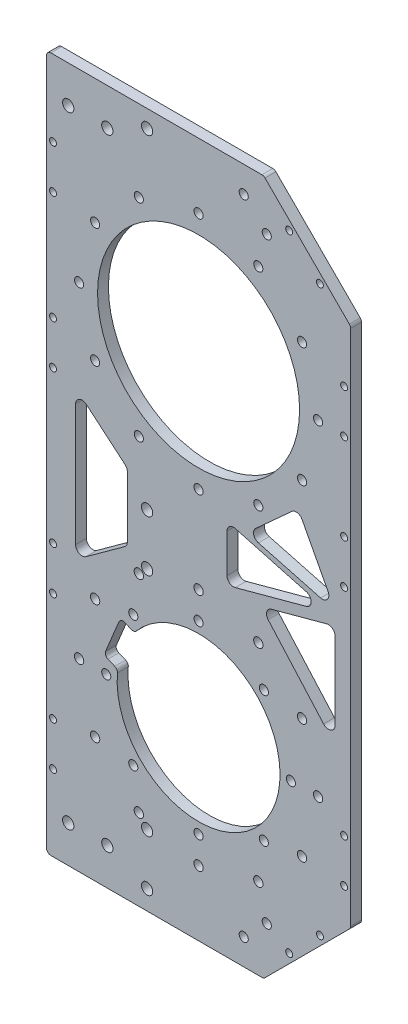
from build123d import *

# Parameters (mm, degrees)
SKETCH_1_W           = 140
SKETCH_1_H           = 320
EXTRUDE_1_DEPTH      = 5
SKETCH_2_R           = 46.5
SKETCH_2_R_2         = 37.5
SKETCH_2_R_3         = 2.1
CUT_EXTRUDE_1_DEPTH  = 5
CUT_EXTRUDE_2_DEPTH  = 5
SKETCH_4_R           = 2.15
CUT_EXTRUDE_3_DEPTH  = 5
SKETCH_5_R           = 2.1
CUT_EXTRUDE_4_DEPTH  = 15
CUT_EXTRUDE_5_DEPTH  = 10
SKETCH_7_R           = 1.6
CUT_EXTRUDE_6_DEPTH  = 327
FILLET_1_R           = 2
FILLET_2_R           = 2
SKETCH_9_R           = 2.6
CUT_EXTRUDE_8_DEPTH  = 10
SKETCH_10_R          = 2.6
CUT_EXTRUDE_9_DEPTH  = 10
SKETCH_11_R          = 2.6
CUT_EXTRUDE_10_DEPTH = 10
SKETCH_12_R          = 1.6
CUT_EXTRUDE_11_DEPTH = 10
SKETCH_13_R          = 2.1
CUT_EXTRUDE_12_DEPTH = 10
CUT_EXTRUDE_13_DEPTH = 10
FILLET_3_R           = 3
FILLET_5_R           = 3
FILLET_6_R           = 3
SKETCH_15_R          = 1.6
CUT_EXTRUDE_14_DEPTH = 10


with BuildPart() as part:
    # 草图1 → 凸台-拉伸1 (new body)
    with BuildSketch(Plane.XY):
        Rectangle(SKETCH_1_W, SKETCH_1_H)
    extrude(amount=EXTRUDE_1_DEPTH)

    # 草图2 → 切除-拉伸1 (cut)
    with BuildSketch(Plane.XY.offset(5)):
        with Locations((0, 75)):
            Circle(SKETCH_2_R)
        with Locations((0, -75)):
            Circle(SKETCH_2_R_2)
        with Locations((42.5, -75)):
            Circle(SKETCH_2_R_3)
        with Locations((30.0520382, -105.0520382)):
            Circle(SKETCH_2_R_3)
        with Locations((0, -117.5)):
            Circle(SKETCH_2_R_3)
        with Locations((-30.0520382, -105.0520382)):
            Circle(SKETCH_2_R_3)
        with Locations((-42.5, -75)):
            Circle(SKETCH_2_R_3)
        with Locations((-30.0520382, -44.9479618)):
            Circle(SKETCH_2_R_3)
        with Locations((0, -32.5)):
            Circle(SKETCH_2_R_3)
        with Locations((30.0520382, -44.9479618)):
            Circle(SKETCH_2_R_3)
    extrude(amount=-CUT_EXTRUDE_1_DEPTH, mode=Mode.SUBTRACT)

    # 草图3 → 切除-拉伸2 (cut)
    with BuildSketch(Plane.XY.offset(5)):
        Polygon((-43.553654222, -67.783407733), (-17.685027311, -78.49854384), (-10.031358664, -60.020953189), (-35.899985574, -49.305817083), align=None)
    extrude(amount=-CUT_EXTRUDE_2_DEPTH, mode=Mode.SUBTRACT)

    # 草图4 → 切除-拉伸3 (cut)
    with BuildSketch(Plane.XY.offset(5)):
        with Locations((0, -20)):
            Circle(SKETCH_4_R)
        with Locations((27.5, -27.368602792)):
            Circle(SKETCH_4_R)
        with Locations((47.631397208, -47.5)):
            Circle(SKETCH_4_R)
        with Locations((55, -75)):
            Circle(SKETCH_4_R)
        with Locations((47.631397208, -102.5)):
            Circle(SKETCH_4_R)
        with Locations((27.5, -122.631397208)):
            Circle(SKETCH_4_R)
        with Locations((0, -130)):
            Circle(SKETCH_4_R)
        with Locations((-27.5, -122.631397208)):
            Circle(SKETCH_4_R)
        with Locations((-47.631397208, -102.5)):
            Circle(SKETCH_4_R)
        with Locations((-55, -75)):
            Circle(SKETCH_4_R)
        with Locations((-47.631397208, -47.5)):
            Circle(SKETCH_4_R)
        with Locations((-27.5, -27.368602792)):
            Circle(SKETCH_4_R)
    extrude(amount=-CUT_EXTRUDE_3_DEPTH, mode=Mode.SUBTRACT)

    # 草图5 → 切除-拉伸4 (cut)
    with BuildSketch(Plane(origin=(0, 0, 0), x_dir=(-1, 0, 0), z_dir=(0, 0, -1))):
        with Locations((0, 130)):
            Circle(SKETCH_5_R)
        with Locations((27.5, 122.631397208)):
            Circle(SKETCH_5_R)
        with Locations((47.631397208, 102.5)):
            Circle(SKETCH_5_R)
        with Locations((55, 75)):
            Circle(SKETCH_5_R)
        with Locations((47.631397208, 47.5)):
            Circle(SKETCH_5_R)
        with Locations((27.5, 27.368602792)):
            Circle(SKETCH_5_R)
        with Locations((0, 20)):
            Circle(SKETCH_5_R)
        with Locations((-27.5, 27.368602792)):
            Circle(SKETCH_5_R)
        with Locations((-47.631397208, 47.5)):
            Circle(SKETCH_5_R)
        with Locations((-55, 75)):
            Circle(SKETCH_5_R)
        with Locations((-47.631397208, 102.5)):
            Circle(SKETCH_5_R)
        with Locations((-27.5, 122.631397208)):
            Circle(SKETCH_5_R)
    extrude(amount=-CUT_EXTRUDE_4_DEPTH, mode=Mode.SUBTRACT)

    # 草图6 → 切除-拉伸5 (cut)
    with BuildSketch(Plane.XY.offset(5)):
        Polygon((30, 160), (70, 120), (70, 160), align=None)
        Polygon((70, -120), (70, -160), (30, -160), align=None)
    extrude(amount=-CUT_EXTRUDE_5_DEPTH, mode=Mode.SUBTRACT)

    # 草图7 → 切除-拉伸6 (cut)
    with BuildSketch(Plane.XY.offset(5)):
        with Locations((41.715728753, -144.04163056)):
            Circle(SKETCH_7_R)
        with Locations((55.857864376, -129.899494937)):
            Circle(SKETCH_7_R)
        with Locations(Location((55.857864376, 129.899494937, 0), (0, 0, 180))):
            Circle(SKETCH_7_R)
        with Locations(Location((41.715728753, 144.04163056, 0), (0, 0, 180))):
            Circle(SKETCH_7_R)
    extrude(amount=-CUT_EXTRUDE_6_DEPTH, mode=Mode.SUBTRACT)

    # 圆角1
    fillet_1_edges = [part.edges().sort_by_distance(p)[0] for p in [
        (30, 160, 2.5),
        (70, 120, 2.5),
        (30, -160, 2.5),
        (70, -120, 2.5),
        (-37.217762979, -70.407819816, 2.5),
        (-29.564094332, -51.930229166, 2.5),
        (-35.899985574, -49.305817083, 2.5),
        (-70, -160, 2.5),
        (-70, 160, 2.5),
    ]]
    fillet(fillet_1_edges, radius=FILLET_1_R)

    # 圆角2
    fillet_2_edges = [part.edges().sort_by_distance(p)[0] for p in [
        (-43.553654222, -67.783407733, 2.5),
    ]]
    fillet(fillet_2_edges, radius=FILLET_2_R)

    # 草图9 → 切除-拉伸8 (cut)
    with BuildSketch(Plane.XY.offset(5)):
        with Locations((-23.7, 0)):
            Circle(SKETCH_9_R)
        with Locations((-23.7, -23.5)):
            Circle(SKETCH_9_R)
        with Locations((-23.7, -151)):
            Circle(SKETCH_9_R)
        with Locations((-23.7, -127.5)):
            Circle(SKETCH_9_R)
    extrude(amount=-CUT_EXTRUDE_8_DEPTH, mode=Mode.SUBTRACT)

    # 草图10 → 切除-拉伸9 (cut)
    with BuildSketch(Plane.XY.offset(5)):
        with Locations((-60, -143)):
            Circle(SKETCH_10_R)
        with Locations(Location((-60, 143, 0), (0, 0, 180))):
            Circle(SKETCH_10_R)
        with Locations((-42, 143)):
            Circle(SKETCH_10_R)
        with Locations(Location((-42, -143, 0), (0, 0, 180))):
            Circle(SKETCH_10_R)
    extrude(amount=-CUT_EXTRUDE_9_DEPTH, mode=Mode.SUBTRACT)

    # 草图11 → 切除-拉伸10 (cut)
    with BuildSketch(Plane.XY.offset(5)):
        with Locations((-23.7, 152)):
            Circle(SKETCH_11_R)
    extrude(amount=-CUT_EXTRUDE_10_DEPTH, mode=Mode.SUBTRACT)

    # 草图12 → 切除-拉伸11 (cut)
    with BuildSketch(Plane.XY.offset(5)):
        with Locations((67, -104.585786438)):
            Circle(SKETCH_12_R)
        with Locations((67, -84.585786438)):
            Circle(SKETCH_12_R)
        with Locations((67, 94.585786438)):
            Circle(SKETCH_12_R)
        with Locations((67, 74.585786438)):
            Circle(SKETCH_12_R)
        with Locations((67, 34.585786438)):
            Circle(SKETCH_12_R)
        with Locations((67, 14.585786438)):
            Circle(SKETCH_12_R)
    extrude(amount=-CUT_EXTRUDE_11_DEPTH, mode=Mode.SUBTRACT)

    # 草图13 → 切除-拉伸12 (cut)
    with BuildSketch(Plane.XY.offset(5)):
        with Locations((20.786796564, 148)):
            Circle(SKETCH_13_R)
        with Locations((31.393398282, 137.393398282)):
            Circle(SKETCH_13_R)
        with Locations(Location((31.393398282, -137.393398282, 0), (0, 0, 180))):
            Circle(SKETCH_13_R)
        with Locations(Location((20.786796564, -148, 0), (0, 0, 180))):
            Circle(SKETCH_13_R)
    extrude(amount=-CUT_EXTRUDE_12_DEPTH, mode=Mode.SUBTRACT)

    # 草图14 → 切除-拉伸13 (cut)
    with BuildSketch(Plane.XY.offset(5)):
        Polygon((13.082912069, 13.840088814), (13.082912069, -11.76243836), (60.305351078, 1.038825227), align=None)
        Polygon((62.808709291, -3.114473625), (28.807148392, -12.33176423), (62.808709291, -50.678279663), align=None)
        Polygon((45.805341988, 35.251376217), (22.206313522, 13.840088814), (62.808709291, 3.011971197), align=None)
        Polygon((-56.619486608, 32.209554881), (-56.619486608, -36.253803925), (-32.797397419, -18.962637445), (-32.797397419, 12.07513926), align=None)
    extrude(amount=-CUT_EXTRUDE_13_DEPTH, mode=Mode.SUBTRACT)

    # 圆角3
    fillet_3_edges = [part.edges().sort_by_distance(p)[0] for p in [
        (62.808709291, -3.114473625, 2.5),
        (62.808709291, -50.678279663, 2.5),
        (28.807148392, -12.33176423, 2.5),
        (13.082912069, 13.840088814, 2.5),
        (60.305351078, 1.038825227, 2.5),
        (13.082912069, -11.76243836, 2.5),
    ]]
    fillet(fillet_3_edges, radius=FILLET_3_R)

    # 圆角5
    fillet_5_edges = [part.edges().sort_by_distance(p)[0] for p in [
        (45.805341988, 35.251376217, 2.5),
        (62.808709291, 3.011971197, 2.5),
        (22.206313522, 13.840088814, 2.5),
    ]]
    fillet(fillet_5_edges, radius=FILLET_5_R)

    # 圆角6
    fillet_6_edges = [part.edges().sort_by_distance(p)[0] for p in [
        (-32.797397419, -18.962637445, 2.5),
        (-56.619486608, -36.253803925, 2.5),
        (-56.619486608, 32.209554881, 2.5),
        (-32.797397419, 12.07513926, 2.5),
    ]]
    fillet(fillet_6_edges, radius=FILLET_6_R)

    # 草图15 → 切除-拉伸14 (cut)
    with BuildSketch(Plane.XY.offset(5)):
        with Locations((-67, -125)):
            Circle(SKETCH_15_R)
        with Locations((-67, -105)):
            Circle(SKETCH_15_R)
        with Locations((-67, -35)):
            Circle(SKETCH_15_R)
        with Locations((-67, -55)):
            Circle(SKETCH_15_R)
        with Locations(Location((-67, 55, 0), (0, 0, 180))):
            Circle(SKETCH_15_R)
        with Locations(Location((-67, 35, 0), (0, 0, 180))):
            Circle(SKETCH_15_R)
        with Locations(Location((-67, 105, 0), (0, 0, 180))):
            Circle(SKETCH_15_R)
        with Locations(Location((-67, 125, 0), (0, 0, 180))):
            Circle(SKETCH_15_R)
    extrude(amount=-CUT_EXTRUDE_14_DEPTH, mode=Mode.SUBTRACT)


solid = part.part
